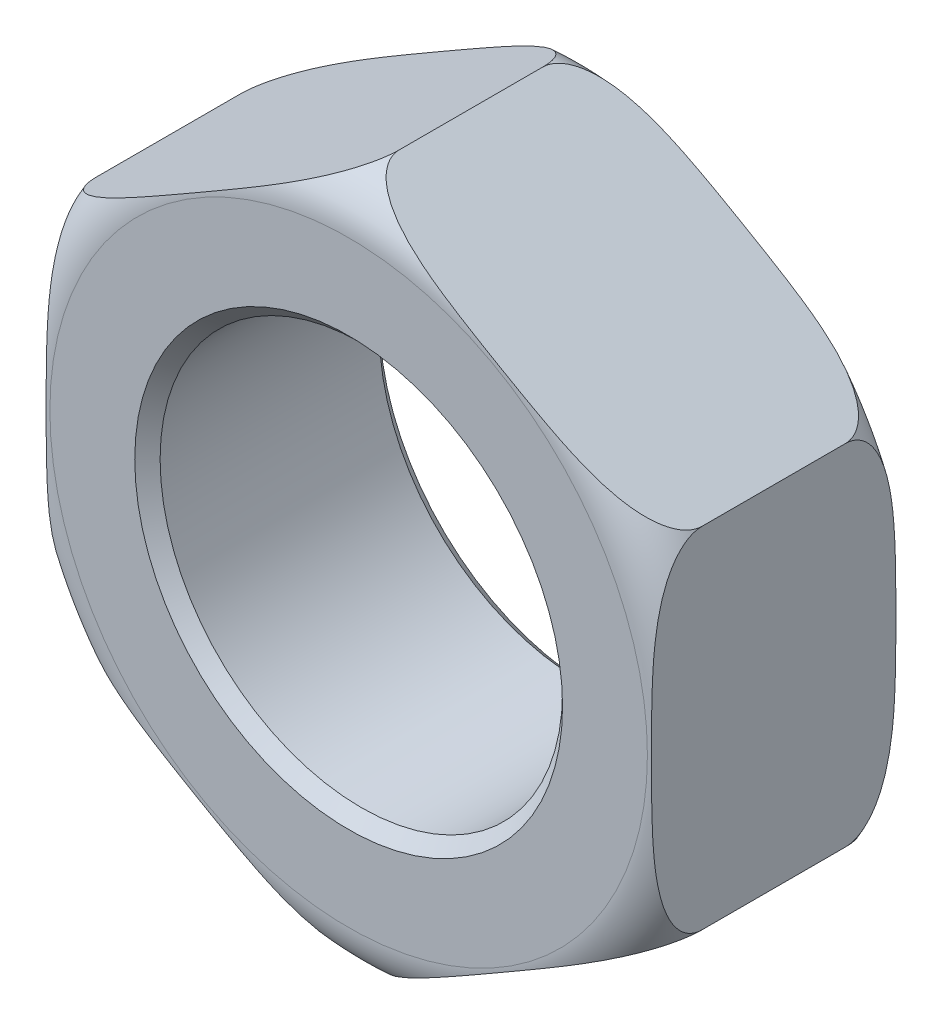
from build123d import *

# Parameters (mm, degrees)
SKETCH1_R      = 7.9375
EXTRUDE1_DEPTH = 4.826


with BuildPart() as part:
    # Sketch1 → Extrude1 (new, symmetric)
    with BuildSketch(Plane.XY):
        Polygon((0, 13.784815027), (-11.938, 6.892407514), (-11.938, -6.892407514), (0, -13.784815027), (11.938, -6.892407514), (11.938, 6.892407514), align=None)
        Circle(SKETCH1_R, mode=Mode.SUBTRACT)
    extrude(amount=EXTRUDE1_DEPTH, both=True)

    # Sketch2 → Detail (revolve, cut)
    with BuildSketch(Plane(origin=(0, 0, 0), x_dir=(0, 0, -1), z_dir=(1, 0, 0)), mode=Mode.PRIVATE) as detail_sk:
        Polygon((4.826, 7.9375), (4.826, 8.4375), (4.326, 7.9375), align=None)
        with BuildLine():
            Line((4.826, 13.784815027), (4.826, 11.784815027))
            ThreePointArc((4.826, 11.784815027), (4.240213562, 13.19902859), (2.826, 13.784815027))
            Line((2.826, 13.784815027), (4.826, 13.784815027))
        make_face()
        with BuildLine():
            Line((-2.826, 13.784815027), (-4.826, 13.784815027))
            Line((-4.826, 13.784815027), (-4.826, 11.784815027))
            ThreePointArc((-4.826, 11.784815027), (-4.240213562, 13.19902859), (-2.826, 13.784815027))
        make_face()
        Polygon((-4.326, 7.9375), (-4.826, 7.9375), (-4.826, 8.4375), align=None)
    revolve(detail_sk.sketch.rotate(Axis((0, 0, 0), (0, 0, -1)), 90), axis=Axis((0, 0, 0), (0, 0, -1)), mode=Mode.SUBTRACT)


solid = part.part
